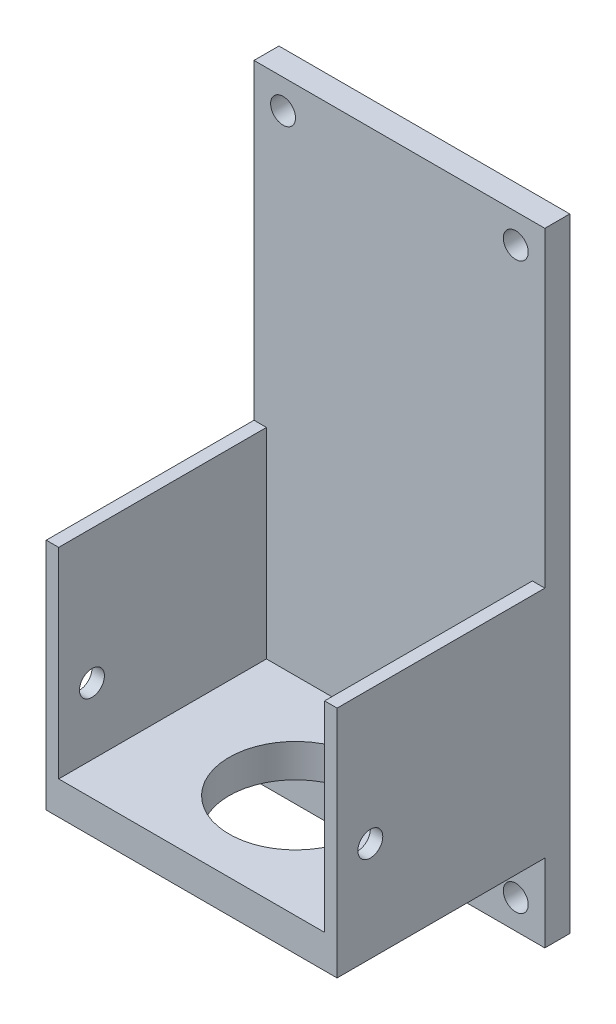
from build123d import *

# Parameters (mm, degrees)
SKETCH1_W           = 35
SKETCH1_H           = 75
BOSS_EXTRUDE1_DEPTH = 3
SKETCH2_R           = 1.5
SIDE_HOLES_DEPTH    = 13
SKETCH3_W           = 32
SKETCH3_H           = 4
BOSS_EXTRUDE2_DEPTH = 25
SKETCH4_R           = 8
CUT_EXTRUDE2_DEPTH  = 5
SKETCH5_W           = 25
SKETCH5_H           = 28.130280997
BOSS_EXTRUDE3_DEPTH = 1.5
SKETCH6_W           = 25
SKETCH6_H           = 28.130280997
BOSS_EXTRUDE4_DEPTH = 1.5
SKETCH7_R           = 1.5
CUT_EXTRUDE3_DEPTH  = 59.440140315


with BuildPart() as part:
    # Sketch1 → Boss-Extrude1 (new body)
    with BuildSketch(Plane.XY):
        Rectangle(SKETCH1_W, SKETCH1_H)
    extrude(amount=BOSS_EXTRUDE1_DEPTH)

    # Sketch2 → side holes (cut)
    with BuildSketch(Plane.XY.offset(3)):
        with Locations((14, 34)):
            Circle(SKETCH2_R)
        with Locations((-14, 34)):
            Circle(SKETCH2_R)
        with Locations((14, -34)):
            Circle(SKETCH2_R)
        with Locations((-14, -34)):
            Circle(SKETCH2_R)
    extrude(amount=-SIDE_HOLES_DEPTH, mode=Mode.SUBTRACT)

    # Sketch3 → Boss-Extrude2 (add)
    with BuildSketch(Plane.XY.offset(3)):
        with Locations((0, -26.130280997)):
            Rectangle(SKETCH3_W, SKETCH3_H)
    extrude(amount=BOSS_EXTRUDE2_DEPTH)

    # Sketch4 → Cut-Extrude2 (cut)
    with BuildSketch(Plane.XZ.offset(28.130280997)):
        with Locations(Location((0, 15.5, 0), (0, 0, 270))):
            Circle(SKETCH4_R)
    extrude(amount=-CUT_EXTRUDE2_DEPTH, mode=Mode.SUBTRACT)

    # Sketch5 → Boss-Extrude3 (add)
    with BuildSketch(Plane.ZY.offset(16)):
        with Locations((15.5, -14.065140499)):
            Rectangle(SKETCH5_W, SKETCH5_H)
    extrude(amount=BOSS_EXTRUDE3_DEPTH)

    # Sketch6 → Boss-Extrude4 (add)
    with BuildSketch(Plane(origin=(16, 0, 0), x_dir=(0, 0, -1), z_dir=(1, 0, 0))):
        with Locations((-15.5, -14.065140499)):
            Rectangle(SKETCH6_W, SKETCH6_H)
    extrude(amount=BOSS_EXTRUDE4_DEPTH)

    # Sketch7 → Cut-Extrude3 (cut, through all)
    with BuildSketch(Plane(origin=(17.5, 0, 0), x_dir=(0, 0, -1), z_dir=(1, 0, 0))):
        with Locations((-24, -16.130280997)):
            Circle(SKETCH7_R)
    extrude(amount=-CUT_EXTRUDE3_DEPTH, mode=Mode.SUBTRACT)


solid = part.part
